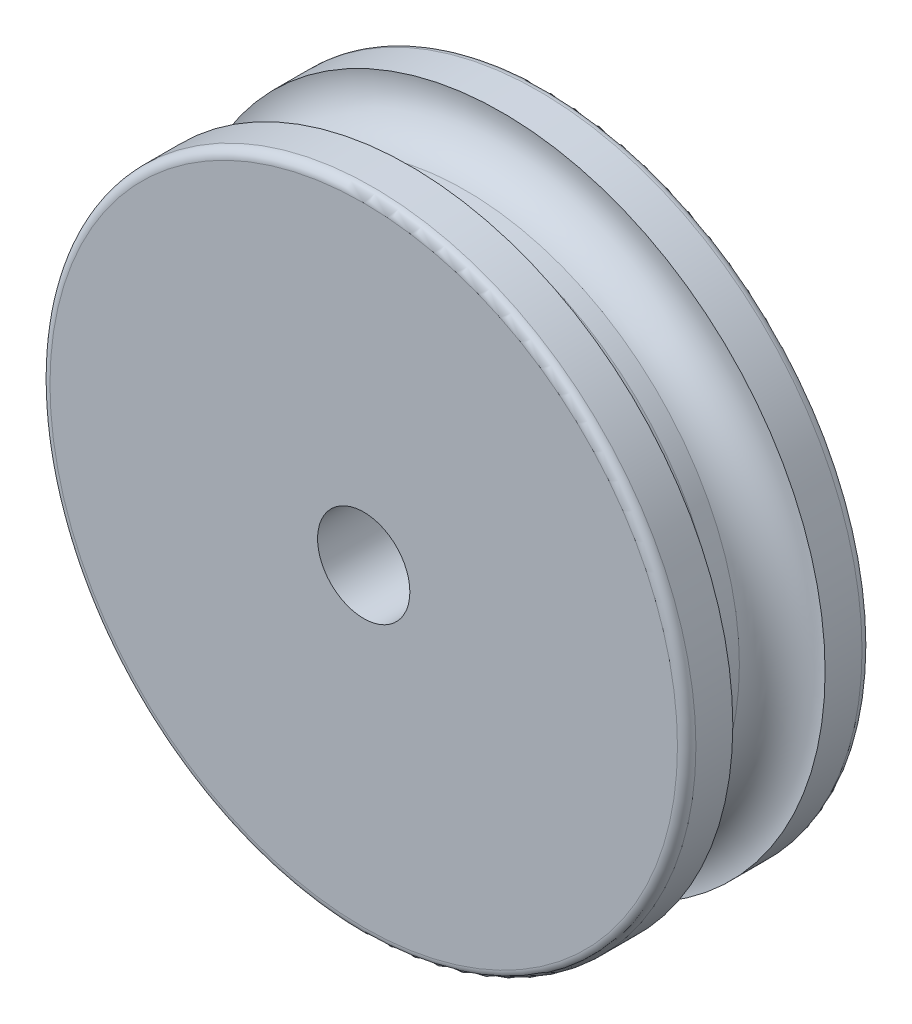
from build123d import *

# Parameters (mm, degrees)
SKETCH_1_R      = 70
SKETCH_1_R_2    = 14.438127561
EXTRUDE_1_DEPTH = 40
SKETCH_2_R      = 14.438127561
SKETCH_2_R_2    = 10
EXTRUDE_2_DEPTH = 40
FILLET_1_R      = 2


with BuildPart() as part:
    # 草图1 → 凸台-拉伸1 (new body)
    with BuildSketch(Plane.XY.offset(70.26)):
        with Locations((-553.234692624, 615.626439551)):
            Circle(SKETCH_1_R)
        with Locations((-553.234692624, 615.626439551)):
            Circle(SKETCH_1_R_2, mode=Mode.SUBTRACT)
    extrude(amount=-EXTRUDE_1_DEPTH)

    # 草图2 → 凸台-拉伸2 (add)
    with BuildSketch(Plane.XY.offset(70.26)):
        with Locations((-553.234692624, 615.626439551)):
            Circle(SKETCH_2_R)
        with Locations((-553.234692624, 615.626439551)):
            Circle(SKETCH_2_R_2, mode=Mode.SUBTRACT)
    extrude(amount=-EXTRUDE_2_DEPTH)

    # 草图4 → 切除-旋转1 (revolve, cut)
    with BuildSketch(Plane(origin=(0, 615.626439551, 0), x_dir=(1, 0, 0), z_dir=(0, 1, 0))):
        with BuildLine():
            Line((-493.814063129, -48.26), (-493.814063129, -52.26))
            ThreePointArc((-493.814063129, -52.26), (-490.181232126, -58.451059372), (-483.234692624, -60.26))
            Line((-483.234692624, -60.26), (-483.234692624, -40.26))
            ThreePointArc((-483.234692624, -40.26), (-490.181232126, -42.068940628), (-493.814063129, -48.26))
        make_face()
    revolve(axis=Axis((-553.234692624, 615.626439551, 70.26), (0, 0, -1)), mode=Mode.SUBTRACT)

    # 圆角1
    fillet_1_edges = [part.edges().sort_by_distance(p)[0] for p in [
        (-623.234692624, 615.626439551, 70.26),
        (-623.234692624, 615.626439551, 30.26),
    ]]
    fillet(fillet_1_edges, radius=FILLET_1_R)


solid = part.part
